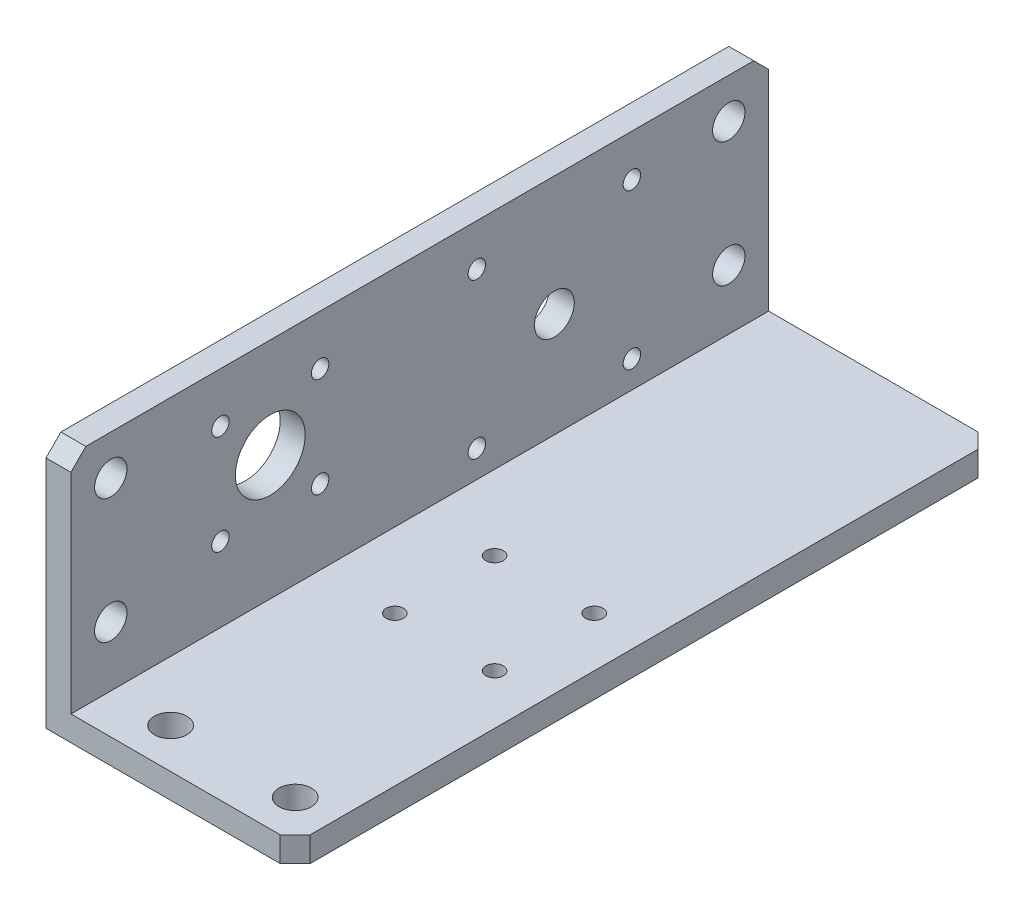
from build123d import *

# Parameters (mm, degrees)
ESTRUSIONE_ESTRUSIONE1_DEPTH = 140
FORO_6_5_6_5_1_D             = 6.5
FORO_6_5_6_5_2_AT_2_COUNT    = 2
FORO_6_5_6_5_2_AT_2_PITCH    = 25
TAGLIO_ESTRUSIONE1_REACH     = 158.844
SCHIZZO8_R                   = 1.75
TAGLIO_ESTRUSIONE2_REACH     = 158.844
SCHIZZO9_R                   = 1.75
SCHIZZO9_R_2                 = 7
TAGLIO_ESTRUSIONE4_REACH     = 158.844
SCHIZZO11_R                  = 4
SCHIZZO11_R_2                = 1.75
SMUSSO1_SIZE                 = 3


with BuildPart() as part:
    # Schizzo1 → Estrusione-Estrusione1 (new body)
    with BuildSketch(Plane.XY):
        Polygon((0, 0), (0, 50), (5, 50), (5, 5), (50, 5), (50, 0), align=None)
    extrude(amount=ESTRUSIONE_ESTRUSIONE1_DEPTH)

    # Foro Ø6.5 (6.5)-1 (through all)
    with Locations(Plane(origin=(0, 0, 0), x_dir=(-1, 0, 0), z_dir=(0, -1, 0))):
        with Locations((-17, -132), (-42, -132)):
            Hole(FORO_6_5_6_5_1_D / 2)

    # Schizzo6 → Foro Ø6.5 (6.5)-2 (revolve, cut)
    with BuildSketch(Plane(origin=(0, 42, 132), x_dir=(0, 0, 1), z_dir=(0, 1, 0))):
        Polygon((0, 0), (0, 6.952797012), (3.25, 5), (3.25, 0), align=None)
    foro_6_5_6_5_2 = revolve(axis=Axis((-6.35, 42, 132), (1, 0, 0)), mode=Mode.SUBTRACT)

    # Foro Ø6.5 (6.5)-2 at 2: Foro Ø6.5 (6.5)-2 ×2
    with Locations(*[(0, -i * FORO_6_5_6_5_2_AT_2_PITCH, 0) for i in range(1, FORO_6_5_6_5_2_AT_2_COUNT)]):
        add(foro_6_5_6_5_2, mode=Mode.SUBTRACT)

    # Specchia1: Foro Ø6.5 (6.5)-2 across plane
    add(foro_6_5_6_5_2.mirror(Plane.XY.offset(70)), mode=Mode.SUBTRACT)

    # Specchia1 copy 1 sketch → Specchia1 copy 1 (revolve, cut)
    with BuildSketch(Plane(origin=(0, 17, 8), x_dir=(0, 0, -1), z_dir=(0, 1, 0))):
        Polygon((0, 0), (0, -6.952797012), (3.25, -5), (3.25, 0), align=None)
    revolve(axis=Axis((-6.35, 17, 8), (-1, 0, 0)), mode=Mode.SUBTRACT)

    # Schizzo8 → Taglio-Estrusione1 (cut, up to next)
    with BuildSketch(Plane.XZ, mode=Mode.PRIVATE) as taglio_estrusione1_sk1:
        with Locations((20, 70)):
            Circle(SCHIZZO8_R)
    taglio_estrusione1_tool1 = extrude(taglio_estrusione1_sk1.sketch, amount=-TAGLIO_ESTRUSIONE1_REACH, mode=Mode.PRIVATE) & part.part
    # Schizzo8 → Taglio-Estrusione1 (cut, up to next)
    with BuildSketch(Plane.XZ, mode=Mode.PRIVATE) as taglio_estrusione1_sk2:
        with Locations((20, 90)):
            Circle(SCHIZZO8_R)
    taglio_estrusione1_tool2 = extrude(taglio_estrusione1_sk2.sketch, amount=-TAGLIO_ESTRUSIONE1_REACH, mode=Mode.PRIVATE) & part.part
    # Schizzo8 → Taglio-Estrusione1 (cut, up to next)
    with BuildSketch(Plane.XZ, mode=Mode.PRIVATE) as taglio_estrusione1_sk3:
        with Locations((40, 90)):
            Circle(SCHIZZO8_R)
    taglio_estrusione1_tool3 = extrude(taglio_estrusione1_sk3.sketch, amount=-TAGLIO_ESTRUSIONE1_REACH, mode=Mode.PRIVATE) & part.part
    # Schizzo8 → Taglio-Estrusione1 (cut, up to next)
    with BuildSketch(Plane.XZ, mode=Mode.PRIVATE) as taglio_estrusione1_sk4:
        with Locations((40, 70)):
            Circle(SCHIZZO8_R)
    taglio_estrusione1_tool4 = extrude(taglio_estrusione1_sk4.sketch, amount=-TAGLIO_ESTRUSIONE1_REACH, mode=Mode.PRIVATE) & part.part
    add(taglio_estrusione1_tool1.solids().sort_by_distance((20, 0, 70))[0], mode=Mode.SUBTRACT)
    add(taglio_estrusione1_tool2.solids().sort_by_distance((20, 0, 90))[0], mode=Mode.SUBTRACT)
    add(taglio_estrusione1_tool3.solids().sort_by_distance((40, 0, 90))[0], mode=Mode.SUBTRACT)
    add(taglio_estrusione1_tool4.solids().sort_by_distance((40, 0, 70))[0], mode=Mode.SUBTRACT)

    # Schizzo9 → Taglio-Estrusione2 (cut, up to next)
    with BuildSketch(Plane.ZY, mode=Mode.PRIVATE) as taglio_estrusione2_sk1:
        with Locations((90, 40)):
            Circle(SCHIZZO9_R)
    taglio_estrusione2_tool1 = extrude(taglio_estrusione2_sk1.sketch, amount=-TAGLIO_ESTRUSIONE2_REACH, mode=Mode.PRIVATE) & part.part
    # Schizzo9 → Taglio-Estrusione2 (cut, up to next)
    with BuildSketch(Plane.ZY, mode=Mode.PRIVATE) as taglio_estrusione2_sk2:
        with Locations((110, 40)):
            Circle(SCHIZZO9_R)
    taglio_estrusione2_tool2 = extrude(taglio_estrusione2_sk2.sketch, amount=-TAGLIO_ESTRUSIONE2_REACH, mode=Mode.PRIVATE) & part.part
    # Schizzo9 → Taglio-Estrusione2 (cut, up to next)
    with BuildSketch(Plane.ZY, mode=Mode.PRIVATE) as taglio_estrusione2_sk3:
        with Locations((110, 20)):
            Circle(SCHIZZO9_R)
    taglio_estrusione2_tool3 = extrude(taglio_estrusione2_sk3.sketch, amount=-TAGLIO_ESTRUSIONE2_REACH, mode=Mode.PRIVATE) & part.part
    # Schizzo9 → Taglio-Estrusione2 (cut, up to next)
    with BuildSketch(Plane.ZY, mode=Mode.PRIVATE) as taglio_estrusione2_sk4:
        with Locations((90, 20)):
            Circle(SCHIZZO9_R)
    taglio_estrusione2_tool4 = extrude(taglio_estrusione2_sk4.sketch, amount=-TAGLIO_ESTRUSIONE2_REACH, mode=Mode.PRIVATE) & part.part
    # Schizzo9 → Taglio-Estrusione2 (cut, up to next)
    with BuildSketch(Plane.ZY, mode=Mode.PRIVATE) as taglio_estrusione2_sk5:
        with Locations((100, 30)):
            Circle(SCHIZZO9_R_2)
    taglio_estrusione2_tool5 = extrude(taglio_estrusione2_sk5.sketch, amount=-TAGLIO_ESTRUSIONE2_REACH, mode=Mode.PRIVATE) & part.part
    add(taglio_estrusione2_tool1.solids().sort_by_distance((0, 40, 90))[0], mode=Mode.SUBTRACT)
    add(taglio_estrusione2_tool2.solids().sort_by_distance((0, 40, 110))[0], mode=Mode.SUBTRACT)
    add(taglio_estrusione2_tool3.solids().sort_by_distance((0, 20, 110))[0], mode=Mode.SUBTRACT)
    add(taglio_estrusione2_tool4.solids().sort_by_distance((0, 20, 90))[0], mode=Mode.SUBTRACT)
    add(taglio_estrusione2_tool5.solids().sort_by_distance((0, 30, 100))[0], mode=Mode.SUBTRACT)

    # Schizzo11 → Taglio-Estrusione4 (cut, up to next)
    with BuildSketch(Plane.ZY, mode=Mode.PRIVATE) as taglio_estrusione4_sk1:
        with Locations((43, 26)):
            Circle(SCHIZZO11_R)
    taglio_estrusione4_tool1 = extrude(taglio_estrusione4_sk1.sketch, amount=-TAGLIO_ESTRUSIONE4_REACH, mode=Mode.PRIVATE) & part.part
    # Schizzo11 → Taglio-Estrusione4 (cut, up to next)
    with BuildSketch(Plane.ZY, mode=Mode.PRIVATE) as taglio_estrusione4_sk2:
        with Locations((58.556349186, 41.556349186)):
            Circle(SCHIZZO11_R_2)
    taglio_estrusione4_tool2 = extrude(taglio_estrusione4_sk2.sketch, amount=-TAGLIO_ESTRUSIONE4_REACH, mode=Mode.PRIVATE) & part.part
    # Schizzo11 → Taglio-Estrusione4 (cut, up to next)
    with BuildSketch(Plane.ZY, mode=Mode.PRIVATE) as taglio_estrusione4_sk3:
        with Locations((58.556349186, 10.443650814)):
            Circle(SCHIZZO11_R_2)
    taglio_estrusione4_tool3 = extrude(taglio_estrusione4_sk3.sketch, amount=-TAGLIO_ESTRUSIONE4_REACH, mode=Mode.PRIVATE) & part.part
    # Schizzo11 → Taglio-Estrusione4 (cut, up to next)
    with BuildSketch(Plane.ZY, mode=Mode.PRIVATE) as taglio_estrusione4_sk4:
        with Locations((27.443650814, 10.443650814)):
            Circle(SCHIZZO11_R_2)
    taglio_estrusione4_tool4 = extrude(taglio_estrusione4_sk4.sketch, amount=-TAGLIO_ESTRUSIONE4_REACH, mode=Mode.PRIVATE) & part.part
    # Schizzo11 → Taglio-Estrusione4 (cut, up to next)
    with BuildSketch(Plane.ZY, mode=Mode.PRIVATE) as taglio_estrusione4_sk5:
        with Locations((27.443650814, 41.556349186)):
            Circle(SCHIZZO11_R_2)
    taglio_estrusione4_tool5 = extrude(taglio_estrusione4_sk5.sketch, amount=-TAGLIO_ESTRUSIONE4_REACH, mode=Mode.PRIVATE) & part.part
    add(taglio_estrusione4_tool1.solids().sort_by_distance((0, 26, 43))[0], mode=Mode.SUBTRACT)
    add(taglio_estrusione4_tool2.solids().sort_by_distance((0, 41.556349, 58.556349))[0], mode=Mode.SUBTRACT)
    add(taglio_estrusione4_tool3.solids().sort_by_distance((0, 10.443651, 58.556349))[0], mode=Mode.SUBTRACT)
    add(taglio_estrusione4_tool4.solids().sort_by_distance((0, 10.443651, 27.443651))[0], mode=Mode.SUBTRACT)
    add(taglio_estrusione4_tool5.solids().sort_by_distance((0, 41.556349, 27.443651))[0], mode=Mode.SUBTRACT)

    # Smusso1
    smusso1_edges = [part.edges().sort_by_distance(p)[0] for p in [
        (2.5, 50, 140),
        (2.5, 50, 0),
        (50, 2.5, 140),
        (50, 2.5, 0),
    ]]
    chamfer(smusso1_edges, length=SMUSSO1_SIZE)


solid = part.part
